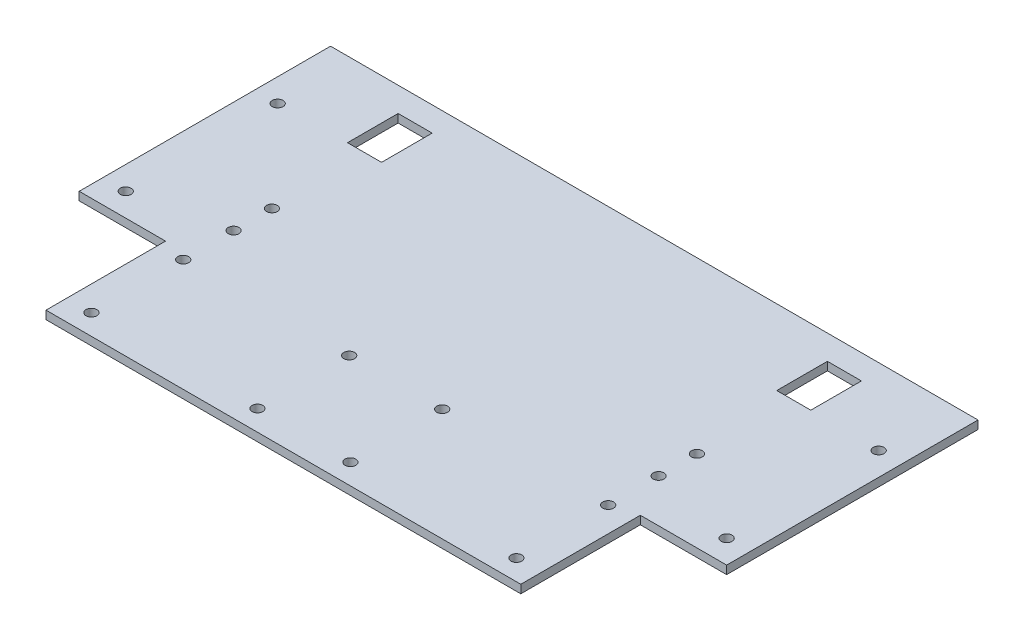
from build123d import *

# Parameters (mm, degrees)
CROQUIS1_R              = 1.625
CUERPO_INICIAL_DEPTH    = 2.5
SALIENTE_EXTRUIR2_DEPTH = 195
CROQUIS7_R              = 1.625
CORTAR_EXTRUIR2_DEPTH   = 10
CROQUIS10_R             = 1.625
CORTAR_EXTRUIR7_DEPTH   = 10
CROQUIS11_W             = 10.25
CROQUIS11_H             = 15.25
CORTAR_EXTRUIR8_DEPTH   = 10
SALIENTE_EXTRUIR3_DEPTH = 195


with BuildPart() as part:
    # Croquis1 → Cuerpo Inicial (new body)
    with BuildSketch(Plane(origin=(0, 0, 0), x_dir=(1, 0, 0), z_dir=(0, 1, 0))):
        Polygon((-71.5, -25), (-71.5, -61), (71.5, -61), (71.5, -25), (97.5, -25), (97.5, 0), (97.5, 1), (97.5, 5.7), (45, 5.7), (-45, 5.7), (-97.5, 5.7), (-97.5, 1), (-97.5, 0), (-97.5, -25), align=None)
        with Locations(Location((-90.5, -18, 0), (0, 0, 270))):
            Circle(CROQUIS1_R, mode=Mode.SUBTRACT)
        with Locations(Location((90.5, -18, 0), (0, 0, 270))):
            Circle(CROQUIS1_R, mode=Mode.SUBTRACT)
    extrude(amount=CUERPO_INICIAL_DEPTH)

    # Croquis3 → Saliente-Extruir2 (add)
    with BuildSketch(Plane(origin=(97.5, 0, 0), x_dir=(0, 0, -1), z_dir=(1, 0, 0))):
        Polygon((5.7, 2.5), (47.783199952, 2.5), (50.7, 0), (5.7, 0), align=None)
    extrude(amount=-SALIENTE_EXTRUIR2_DEPTH)

    # Croquis7 → Cortar-Extruir2 (cut)
    with BuildSketch(Plane(origin=(0, 2.5, 0), x_dir=(1, 0, 0), z_dir=(0, 1, 0))):
        with Locations(Location((90.5, 27.783199952, 0), (0, 0, 270))):
            Circle(CROQUIS7_R)
        with Locations(Location((-90.5, 27.783199952, 0), (0, 0, 270))):
            Circle(CROQUIS7_R)
    extrude(amount=-CORTAR_EXTRUIR2_DEPTH, mode=Mode.SUBTRACT)

    # Croquis10 → Cortar-Extruir7 (cut)
    with BuildSketch(Plane(origin=(0, 2.5, -2.5), x_dir=(1, 0, 0), z_dir=(0, -1, 0))):
        with Locations(Location((64, 2.96, 0), (0, 0, 90))):
            Circle(CROQUIS10_R)
        with Locations(Location((64, 14.5, 0), (0, 0, 90))):
            Circle(CROQUIS10_R)
        with Locations(Location((-64, 2.96, 0), (0, 0, 90))):
            Circle(CROQUIS10_R)
        with Locations(Location((-64, 14.5, 0), (0, 0, 90))):
            Circle(CROQUIS10_R)
        with Locations(Location((64, 29.6754, 0), (0, 0, 90))):
            Circle(CROQUIS10_R)
        with Locations(Location((64, 57.3245, 0), (0, 0, 90))):
            Circle(CROQUIS10_R)
        with Locations(Location((-64, 57.3245, 0), (0, 0, 90))):
            Circle(CROQUIS10_R)
        with Locations(Location((-64, 29.6754, 0), (0, 0, 90))):
            Circle(CROQUIS10_R)
        with Locations(Location((14, 29.6754, 0), (0, 0, 90))):
            Circle(CROQUIS10_R)
        with Locations(Location((14, 57.3245, 0), (0, 0, 90))):
            Circle(CROQUIS10_R)
        with Locations(Location((-14, 57.3245, 0), (0, 0, 90))):
            Circle(CROQUIS10_R)
        with Locations(Location((-14, 29.6754, 0), (0, 0, 90))):
            Circle(CROQUIS10_R)
    extrude(amount=CORTAR_EXTRUIR7_DEPTH, mode=Mode.SUBTRACT)

    # Croquis11 → Cortar-Extruir8 (cut)
    with BuildSketch(Plane.XZ):
        with Locations((-64.64307361, -35.7)):
            Rectangle(CROQUIS11_W, CROQUIS11_H)
        with Locations((64.64307361, -35.7)):
            Rectangle(CROQUIS11_W, CROQUIS11_H)
    extrude(amount=-CORTAR_EXTRUIR8_DEPTH, mode=Mode.SUBTRACT)

    # Croquis12 → Saliente-Extruir3 (add)
    with BuildSketch(Plane.ZY.offset(97.5)):
        Polygon((-50.7, 0), (-47.783199952, 2.5), (-50.7, 2.5), align=None)
    extrude(amount=-SALIENTE_EXTRUIR3_DEPTH)


solid = part.part
